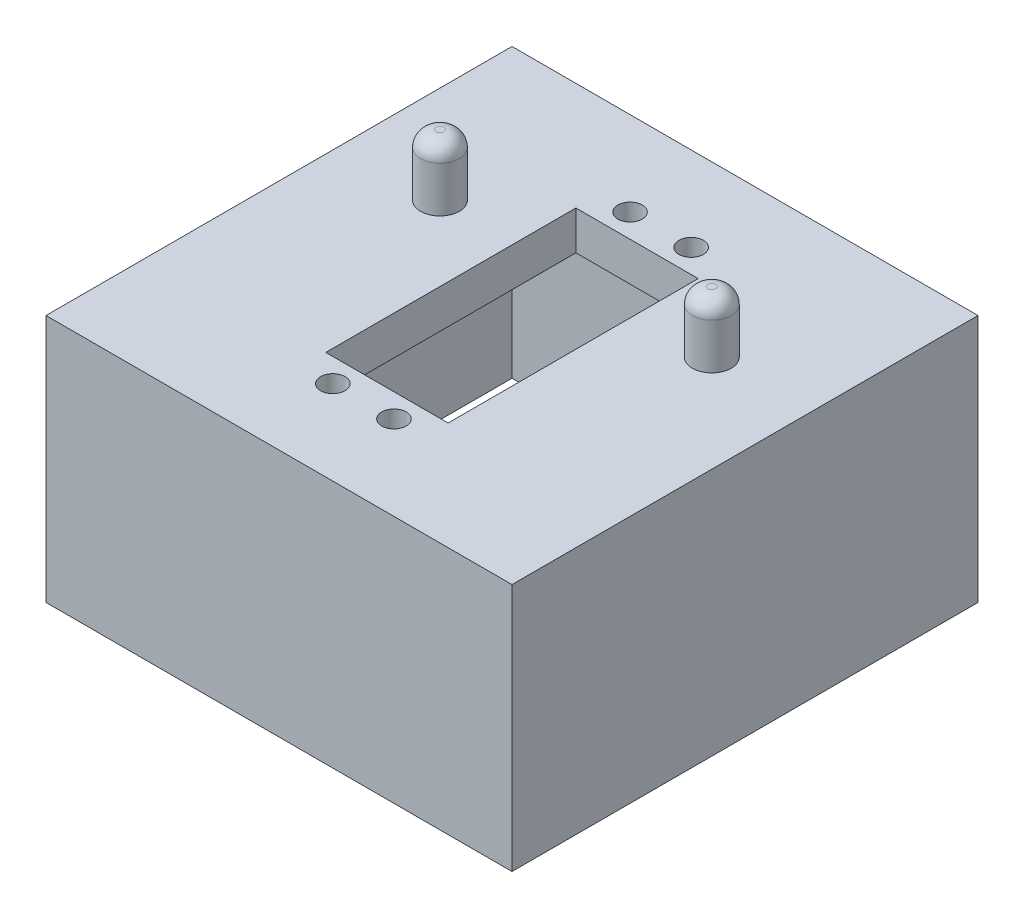
from build123d import *

# Parameters (mm, degrees)
SKETCH1_W           = 53.6
SKETCH1_H           = 40.64
SKETCH1_W_2         = 11.3
BOSS_EXTRUDE1_DEPTH = 76.2
SHELL1_T            = -6.35
SKETCH2_W           = 20
SKETCH2_H           = 40.9
SKETCH2_R           = 2
CUT_EXTRUDE1_DEPTH  = 116.171565935
SKETCH3_R           = 3.175
BOSS_EXTRUDE2_DEPTH = 10
FILLET2_R           = 2.54
CUT_EXTRUDE2_REACH  = 121.068
SKETCH5_W           = 12.7
SKETCH5_H           = 6.35


with BuildPart() as part:
    # Sketch1 → Boss-Extrude1 (new body)
    with BuildSketch(Plane.XY):
        with Locations((38.1, 20.32)):
            Rectangle(SKETCH1_W, SKETCH1_H)
        with Locations((5.65, 20.32)):
            Rectangle(SKETCH1_W_2, SKETCH1_H)
        with Locations((70.55, 20.32)):
            Rectangle(SKETCH1_W_2, SKETCH1_H)
    extrude(amount=BOSS_EXTRUDE1_DEPTH)

    # Shell1
    shell1_openings = [part.faces().sort_by_distance(p)[0] for p in [
        (38.1, 0, 38.1),
    ]]
    offset(amount=SHELL1_T, openings=shell1_openings, kind=Kind.INTERSECTION)

    # Sketch2 → Cut-Extrude1 (cut, through all)
    with BuildSketch(Plane(origin=(0, 40.64, 0), x_dir=(1, 0, 0), z_dir=(0, 1, 0))):
        with Locations((38.1, -38.1)):
            Rectangle(SKETCH2_W, SKETCH2_H)
        with Locations(Location((43.1, -62.4, 0), (0, 0, 270))):
            Circle(SKETCH2_R)
        with Locations(Location((33.1, -62.4, 0), (0, 0, 270))):
            Circle(SKETCH2_R)
        with Locations(Location((33.1, -13.8, 0), (0, 0, 270))):
            Circle(SKETCH2_R)
        with Locations(Location((43.1, -13.8, 0), (0, 0, 270))):
            Circle(SKETCH2_R)
    extrude(amount=-CUT_EXTRUDE1_DEPTH, mode=Mode.SUBTRACT)

    # Sketch3 → Boss-Extrude2 (add)
    with BuildSketch(Plane(origin=(0, 40.64, 0), x_dir=(1, 0, 0), z_dir=(0, 1, 0))):
        with Locations(Location((15.875, -27.65044, 0), (0, 0, 270))):
            Circle(SKETCH3_R)
        with Locations(Location((60.325, -27.65044, 0), (0, 0, 270))):
            Circle(SKETCH3_R)
    extrude(amount=BOSS_EXTRUDE2_DEPTH)

    # Fillet2
    fillet2_edges = [part.edges().sort_by_distance(p)[0] for p in [
        (15.875, 50.64, 24.47544),
        (60.325, 50.64, 24.47544),
    ]]
    fillet(fillet2_edges, radius=FILLET2_R)

    # Sketch5 → Cut-Extrude2 (cut, up to next)
    with BuildSketch(Plane(origin=(0, 0, 0), x_dir=(-1, 0, 0), z_dir=(0, 0, -1)), mode=Mode.PRIVATE) as cut_extrude2_sk1:
        with Locations((-38.1, 3.175)):
            Rectangle(SKETCH5_W, SKETCH5_H)
    cut_extrude2_tool1 = extrude(cut_extrude2_sk1.sketch, amount=-CUT_EXTRUDE2_REACH, mode=Mode.PRIVATE) & part.part
    add(cut_extrude2_tool1.solids().sort_by_distance((38.1, 3.175, 0))[0], mode=Mode.SUBTRACT)


solid = part.part
